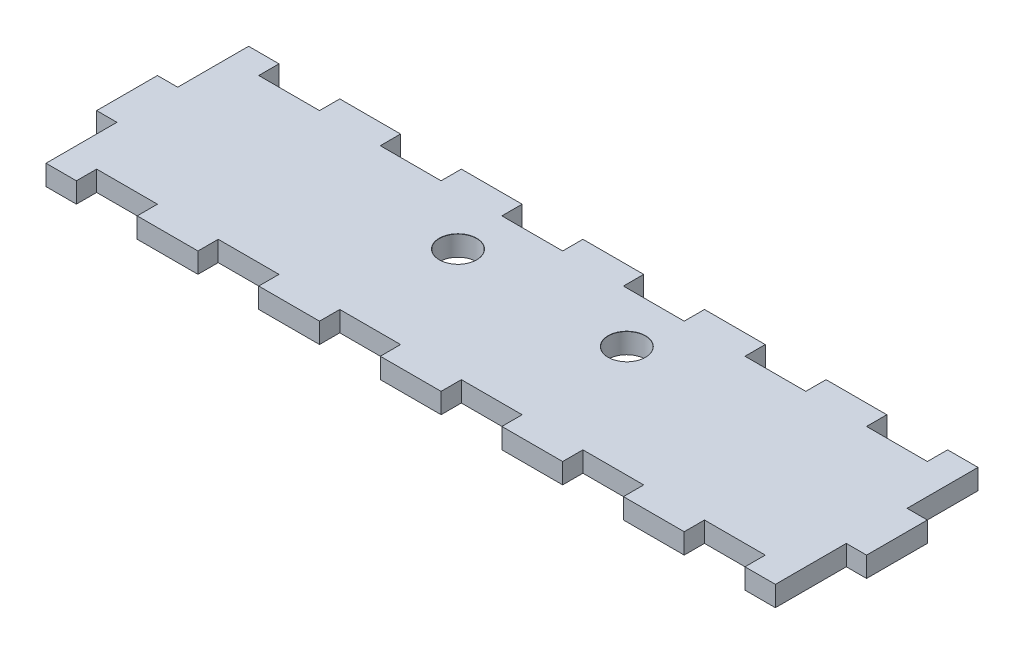
from build123d import *

# Parameters (mm, degrees)
BOSS_EXTRUDE1_DEPTH            = 1.5
M5_CLEARANCE_HOLE1_D           = 5.5
M5_CLEARANCE_HOLE1_CSINK_D     = 5.55
M5_CLEARANCE_HOLE1_CSINK_ANGLE = 90


with BuildPart() as part:
    # Sketch1 → Boss-Extrude1 (new, symmetric)
    with BuildSketch(Plane(origin=(0, 0, 0), x_dir=(1, 0, 0), z_dir=(0, 1, 0))):
        Polygon((54, 15), (49.5, 15), (49.5, 12), (40.5, 12), (40.5, 15), (31.5, 15), (31.5, 12), (22.5, 12), (22.5, 15), (13.5, 15), (13.5, 12), (4.5, 12), (4.5, 15), (-4.5, 15), (-4.5, 12), (-13.5, 12), (-13.5, 15), (-22.5, 15), (-22.5, 12), (-31.5, 12), (-31.5, 15), (-40.5, 15), (-40.5, 12), (-49.5, 12), (-49.5, 15), (-54, 15), (-54, 12), (-54, 4.5), (-57, 4.5), (-57, -4.5), (-54, -4.5), (-54, -12), (-54, -15), (-49.5, -15), (-49.5, -12), (-40.5, -12), (-40.5, -15), (-31.5, -15), (-31.5, -12), (-22.5, -12), (-22.5, -15), (-13.5, -15), (-13.5, -12), (-4.5, -12), (-4.5, -15), (4.5, -15), (4.5, -12), (13.5, -12), (13.5, -15), (22.5, -15), (22.5, -12), (31.5, -12), (31.5, -15), (40.5, -15), (40.5, -12), (49.5, -12), (49.5, -15), (54, -15), (54, -12), (54, -4.5), (57, -4.5), (57, 4.5), (54, 4.5), (54, 12), align=None)
    extrude(amount=BOSS_EXTRUDE1_DEPTH, both=True)

    # M5 Clearance Hole1 (through all)
    with Locations(Plane(origin=(0, 1.5, 0), x_dir=(1, 0, 0), z_dir=(0, 1, 0))):
        with Locations((-12.5, 4.5), (12.5, 4.5)):
            CounterSinkHole(M5_CLEARANCE_HOLE1_D / 2, M5_CLEARANCE_HOLE1_CSINK_D / 2, counter_sink_angle=M5_CLEARANCE_HOLE1_CSINK_ANGLE)


solid = part.part
